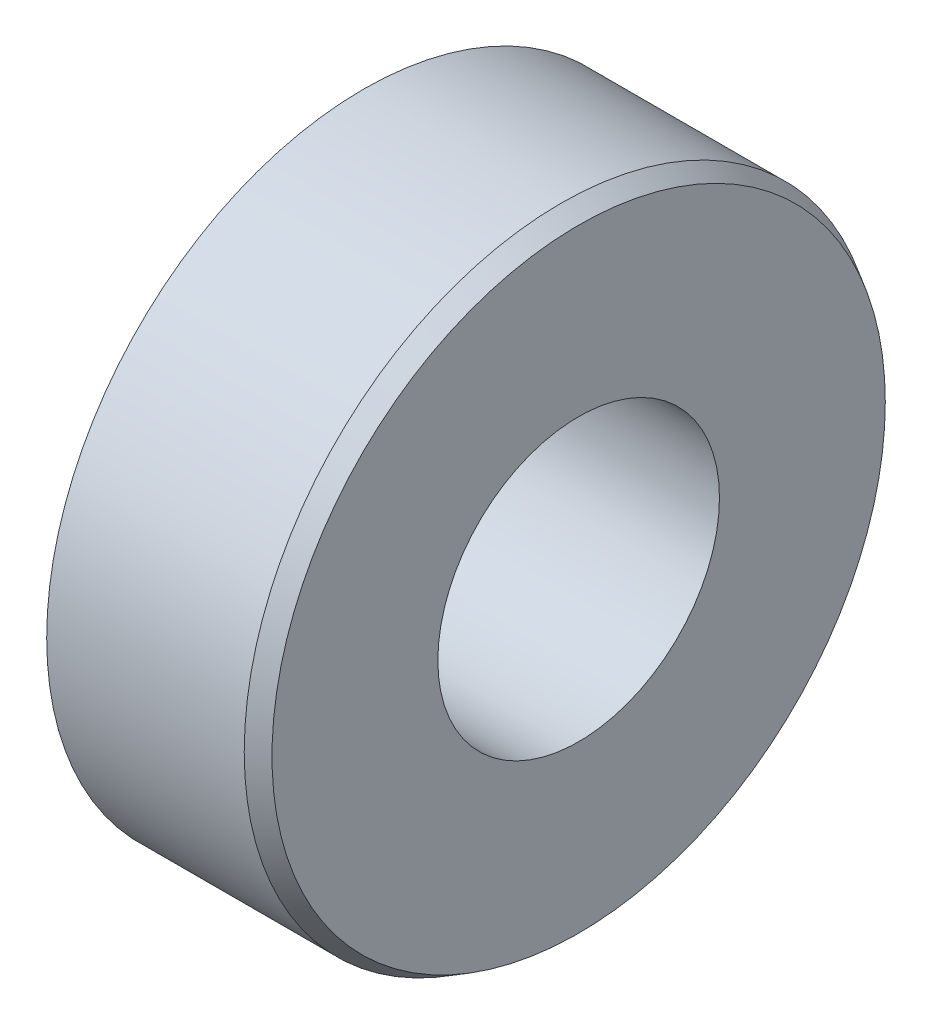
from build123d import *
from OCP.BRepFilletAPI import BRepFilletAPI_MakeChamfer

# Parameters (mm, degrees)
SCHIZZO1_R        = 45
SCHIZZO1_R_2      = 20
ESTRUSIONE1_DEPTH = 32
SMUSSO1_SIZE      = 2.5
SMUSSO1_SIZE2     = 1.443375673


with BuildPart() as part:
    # Schizzo1 → Estrusione1 (new body)
    with BuildSketch(Plane(origin=(0, 0, 0), x_dir=(0, 0, -1), z_dir=(1, 0, 0))):
        Circle(SCHIZZO1_R)
        Circle(SCHIZZO1_R_2, mode=Mode.SUBTRACT)
    extrude(amount=ESTRUSIONE1_DEPTH)

    # Smusso1: one chamfer whose edges measure the first distance from different faces: ONE call of the kernel's chamfer builder (chamfer() names one face for all edges)
    smusso1_edges_1 = [part.edges().sort_by_distance(p)[0] for p in [
        (0, 0, 45),
    ]]
    smusso1_side_1 = [part.faces().sort_by_distance(p)[0] for p in [
        (0, 0, 43.727207794),
    ]]
    smusso1_edges_2 = [part.edges().sort_by_distance(p)[0] for p in [
        (32, 0, 45),
    ]]
    smusso1_side_2 = [part.faces().sort_by_distance(p)[0] for p in [
        (16, 0, 45),
    ]]
    smusso1 = BRepFilletAPI_MakeChamfer(part.part.solid().wrapped)
    for e in smusso1_edges_1:
        smusso1.Add(SMUSSO1_SIZE, SMUSSO1_SIZE2, e.wrapped, smusso1_side_1[0].wrapped)  # the first distance lies on this face
    for e in smusso1_edges_2:
        smusso1.Add(SMUSSO1_SIZE, SMUSSO1_SIZE2, e.wrapped, smusso1_side_2[0].wrapped)  # the first distance lies on this face
    add(Compound.cast(smusso1.Shape()), mode=Mode.REPLACE)


solid = part.part
